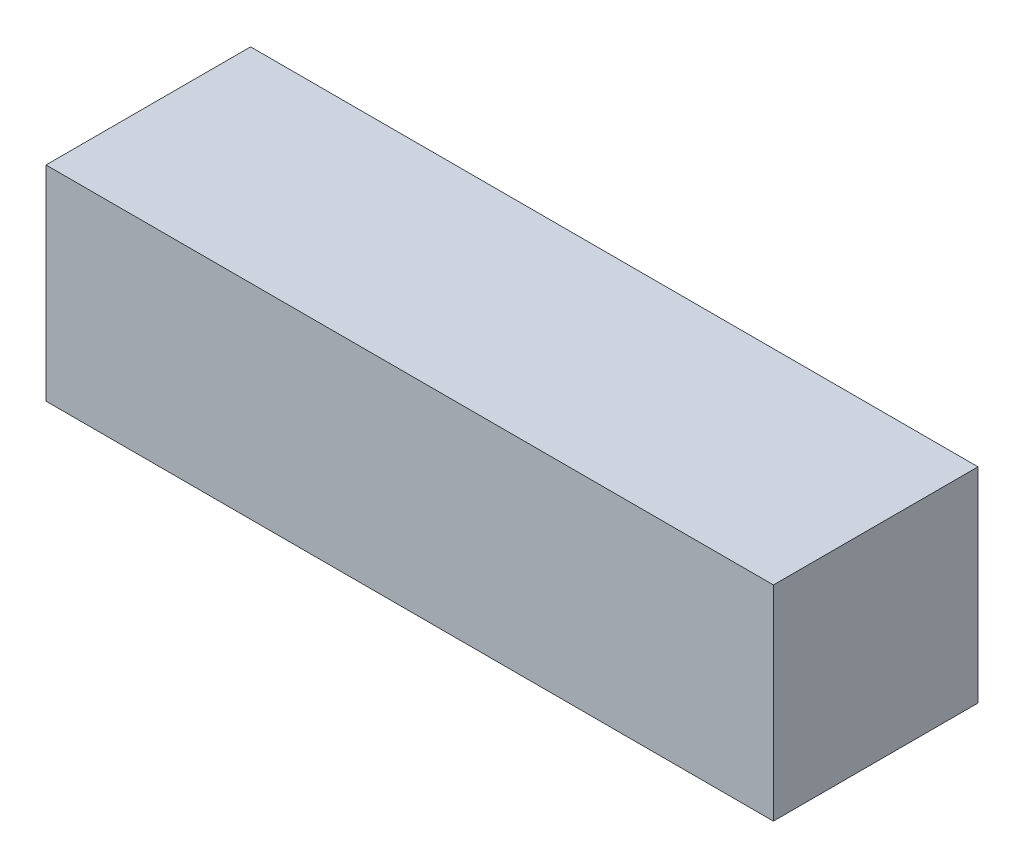
from build123d import *

# Parameters (mm, degrees)
SKETCH_1_W      = 160
SKETCH_1_H      = 45
EXTRUDE_1_DEPTH = 45


with BuildPart() as part:
    # 草图1 → 凸台-拉伸1 (new body)
    with BuildSketch(Plane.XY):
        Rectangle(SKETCH_1_W, SKETCH_1_H)
    extrude(amount=EXTRUDE_1_DEPTH)


solid = part.part
